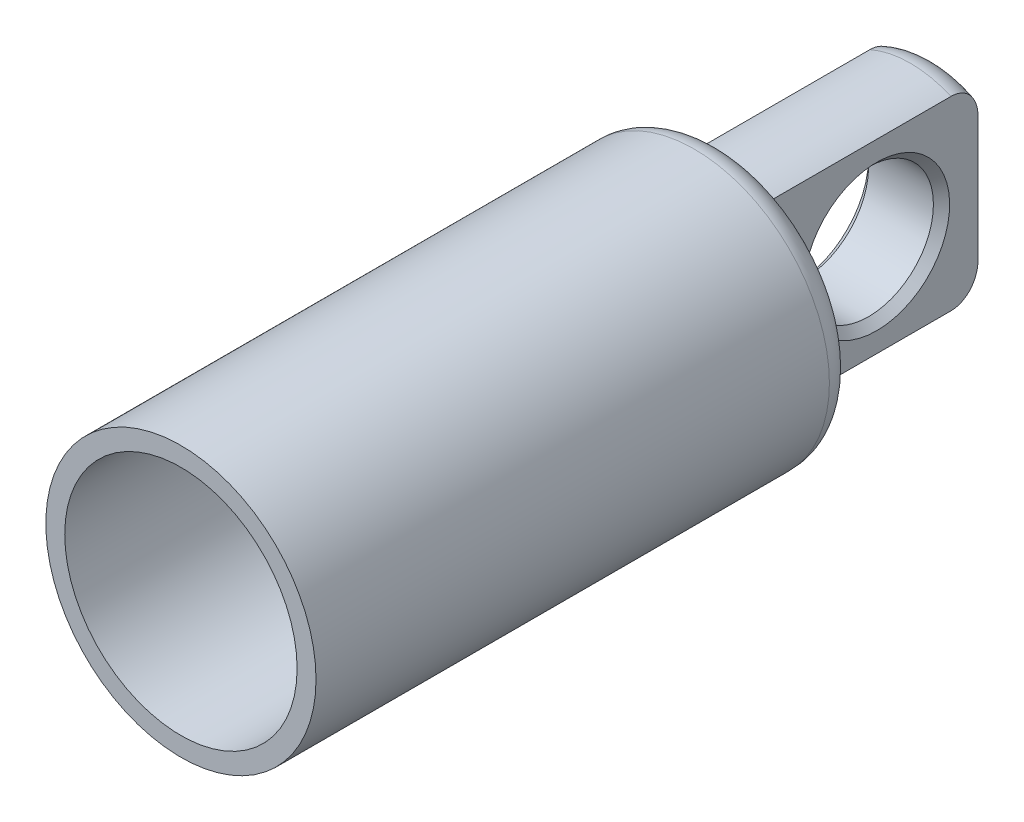
from build123d import *

# Parameters (mm, degrees)
SKETCH1_R               = 6.35
BOSS_EXTRUDE1_DEPTH     = 25.4
SHELL1_T                = -0.889
FILLET1_R               = 1.27
SKETCH2_R               = 4.7625
BOSS_EXTRUDE2_DEPTH     = 10.16
CUT_EXTRUDE1_START      = -10.16
CUT_EXTRUDE1_DEPTH      = 10.16
CUT_EXTRUDE2_DEPTH      = 28.452277251
CUT_EXTRUDE2_DEPTH_BACK = 28.452277251
SKETCH4_R               = 3.048
CHAMFER2_SIZE           = 0.381
FILLET2_R               = 1.27


with BuildPart() as part:
    # Sketch1 → Boss-Extrude1 (new body)
    with BuildSketch(Plane.XY):
        Circle(SKETCH1_R)
    extrude(amount=BOSS_EXTRUDE1_DEPTH)

    # Shell1
    shell1_openings = [part.faces().sort_by_distance(p)[0] for p in [
        (0, 0, 25.4),
    ]]
    offset(amount=SHELL1_T, openings=shell1_openings, kind=Kind.INTERSECTION)

    # Fillet1
    fillet1_edges = [part.edges().sort_by_distance(p)[0] for p in [
        (-6.35, 0, 0),
    ]]
    fillet(fillet1_edges, radius=FILLET1_R)

    # Sketch2 → Boss-Extrude2 (add)
    with BuildSketch(Plane(origin=(0, 0, 0), x_dir=(-1, 0, 0), z_dir=(0, 0, -1))):
        with Locations(Location((0, 0, 0), (0, 0, 180))):
            Circle(SKETCH2_R)
    extrude(amount=BOSS_EXTRUDE2_DEPTH)

    # Sketch3 → Cut-Extrude1 (cut)
    with BuildSketch(Plane(origin=(0, 0, -10.16), x_dir=(-1, 0, 0), z_dir=(0, 0, -1)).offset(CUT_EXTRUDE1_START)):
        with BuildLine():
            Line((-1.905, 4.364903349), (-1.905, -4.364903349))
            ThreePointArc((-1.905, -4.364903349), (-4.7625, 0), (-1.905, 4.364903349))
        make_face()
        with BuildLine():
            Line((1.905, 4.364903349), (1.905, -4.364903349))
            ThreePointArc((1.905, -4.364903349), (4.7625, 0), (1.905, 4.364903349))
        make_face()
    extrude(amount=CUT_EXTRUDE1_DEPTH, mode=Mode.SUBTRACT)

    # Sketch4 → Cut-Extrude2 (cut, two sides: drawn at the far end of the back side and taken through both)
    with BuildSketch(Plane(origin=(1.905, 0, 0), x_dir=(0, 0, -1), z_dir=(1, 0, 0)).offset(-CUT_EXTRUDE2_DEPTH_BACK)):
        with Locations(Location((5.3975, 0, 0), (0, 0, 90))):
            Circle(SKETCH4_R)
    extrude(amount=CUT_EXTRUDE2_DEPTH + CUT_EXTRUDE2_DEPTH_BACK, mode=Mode.SUBTRACT)

    # Chamfer2
    chamfer2_edges = [part.edges().sort_by_distance(p)[0] for p in [
        (1.905, -3.048, -5.3975),
        (-1.905, -3.048, -5.3975),
    ]]
    chamfer(chamfer2_edges, length=CHAMFER2_SIZE)

    # Fillet2
    fillet2_edges = [part.edges().sort_by_distance(p)[0] for p in [
        (0, 4.7625, -10.16),
        (0, -4.7625, -10.16),
    ]]
    fillet(fillet2_edges, radius=FILLET2_R)


solid = part.part
